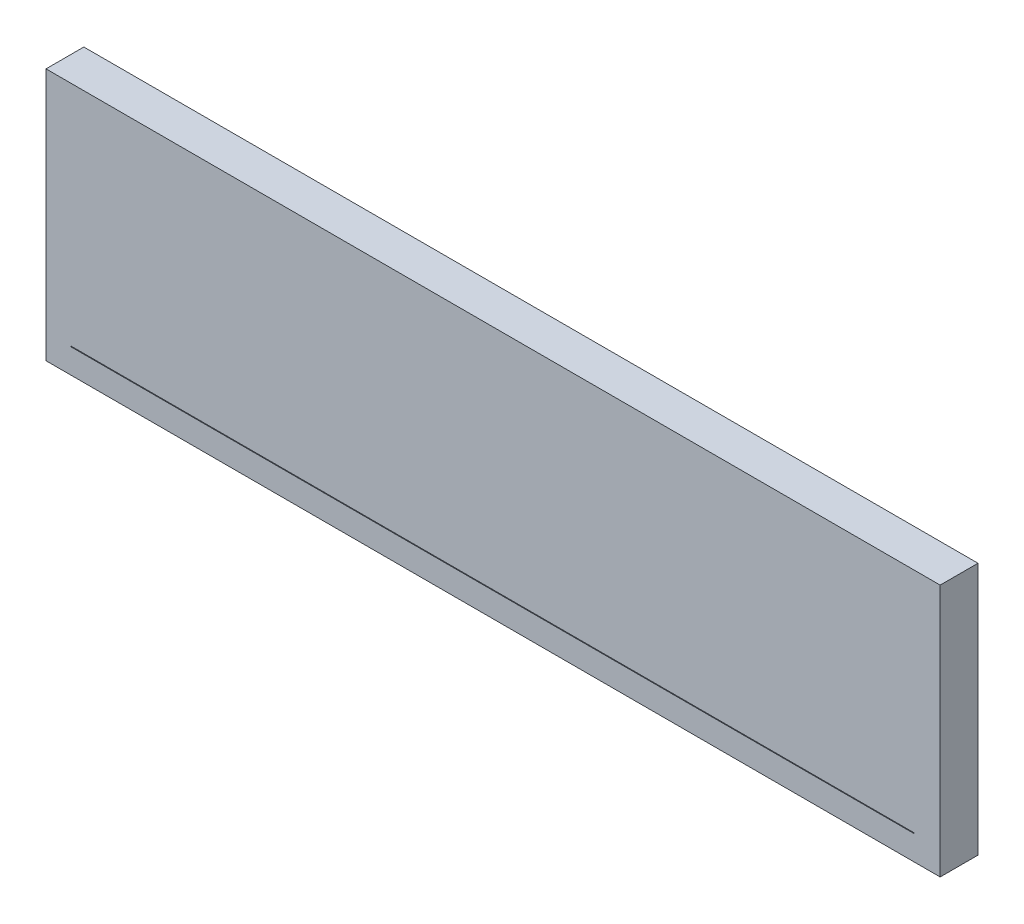
from build123d import *

# Parameters (mm, degrees)
SKETCH_1_W      = 33.4
SKETCH_1_H      = 8.02
EXTRUDE_1_DEPTH = 1
SKETCH_2_W      = 33.4
SKETCH_2_H      = 8.047596292
EXTRUDE_2_DEPTH = 1.5


with BuildPart() as part:
    # 스케치1 → 보스-돌출1 (new body)
    with BuildSketch(Plane.XY):
        Rectangle(SKETCH_1_W, SKETCH_1_H)
    extrude(amount=EXTRUDE_1_DEPTH)

    # 스케치2 → 보스-돌출2 (add)
    with BuildSketch(Plane.XY.offset(1)):
        Polygon((-16.7, 5.01), (17.743446376, 5.01), (17.743446376, 4.01), (17.743446376, -5.011), (16.7, -5.011), (-17.7, -5.011), (-17.7, -4.037596292), (-17.7, 5.01), align=None)
        with Locations((0, -0.013798146)):
            Rectangle(SKETCH_2_W, SKETCH_2_H, mode=Mode.SUBTRACT)
    extrude(amount=-EXTRUDE_2_DEPTH)


solid = part.part
